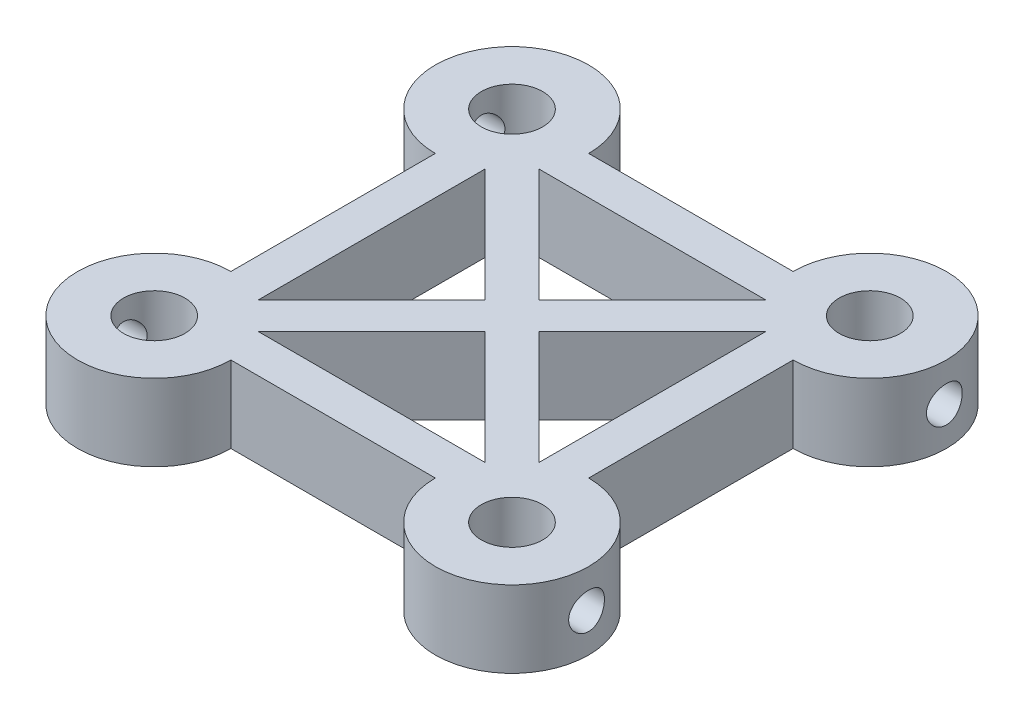
from build123d import *

# Parameters (mm, degrees)
SKETCH1_W           = 28
SKETCH1_H           = 28
BOSS_EXTRUDE1_DEPTH = 6
SKETCH2_R           = 6
BOSS_EXTRUDE2_DEPTH = 6
SKETCH3_R           = 2.4
CUT_EXTRUDE1_DEPTH  = 49.456165758
CUT_EXTRUDE2_DEPTH  = 10
SKETCH5_R           = 1.4
CUT_EXTRUDE3_DEPTH  = 10
CUT_EXTRUDE4_START  = 10
SKETCH6_R           = 1.4
CUT_EXTRUDE4_DEPTH  = 10


with BuildPart() as part:
    # Sketch1 → Boss-Extrude1 (new body)
    with BuildSketch(Plane(origin=(0, 0, 0), x_dir=(1, 0, 0), z_dir=(0, 1, 0))):
        with Locations((14, 14)):
            Rectangle(SKETCH1_W, SKETCH1_H)
    extrude(amount=BOSS_EXTRUDE1_DEPTH)

    # Sketch2 → Boss-Extrude2 (add)
    with BuildSketch(Plane(origin=(0, 6, 0), x_dir=(1, 0, 0), z_dir=(0, 1, 0))):
        with Locations((0, 28)):
            Circle(SKETCH2_R)
        with Locations((28, 28)):
            Circle(SKETCH2_R)
        with Locations((28, 0)):
            Circle(SKETCH2_R)
        Circle(SKETCH2_R)
    extrude(amount=-BOSS_EXTRUDE2_DEPTH)

    # Sketch3 → Cut-Extrude1 (cut, through all)
    with BuildSketch(Plane(origin=(0, 6, 0), x_dir=(1, 0, 0), z_dir=(0, 1, 0))):
        with Locations(Location((0, 28, 0), (0, 0, 270))):
            Circle(SKETCH3_R)
        with Locations(Location((28, 28, 0), (0, 0, 90))):
            Circle(SKETCH3_R)
        with Locations(Location((28, 0, 0), (0, 0, 270))):
            Circle(SKETCH3_R)
        with Locations(Location((0, 0, 0), (0, 0, 90))):
            Circle(SKETCH3_R)
    extrude(amount=-CUT_EXTRUDE1_DEPTH, mode=Mode.SUBTRACT)

    # Sketch4 → Cut-Extrude2 (cut)
    with BuildSketch(Plane(origin=(0, 6, 0), x_dir=(1, 0, 0), z_dir=(0, 1, 0))):
        Polygon((11.878679656, 14), (3, 22.878679656), (3, 5.121320344), align=None)
        Polygon((22.878679656, 25), (5.121320344, 25), (14, 16.121320344), align=None)
        Polygon((25, 5.121320344), (25, 22.878679656), (16.121320344, 14), align=None)
        Polygon((14, 11.878679656), (5.121320344, 3), (22.878679656, 3), align=None)
    extrude(amount=-CUT_EXTRUDE2_DEPTH, mode=Mode.SUBTRACT)

    # Sketch5 → Cut-Extrude3 (cut)
    with BuildSketch(Plane(origin=(28, 0, 0), x_dir=(0, 0, -1), z_dir=(1, 0, 0))):
        with Locations(Location((0, 3, 0), (0, 0, 180))):
            Circle(SKETCH5_R)
        with Locations(Location((28, 3, 0), (0, 0, 180))):
            Circle(SKETCH5_R)
    extrude(amount=CUT_EXTRUDE3_DEPTH, mode=Mode.SUBTRACT)

    # Sketch6 → Cut-Extrude4 (cut)
    with BuildSketch(Plane.ZY.offset(CUT_EXTRUDE4_START)):
        with Locations((-28, 3)):
            Circle(SKETCH6_R)
        with Locations((0, 3)):
            Circle(SKETCH6_R)
    extrude(amount=-CUT_EXTRUDE4_DEPTH, mode=Mode.SUBTRACT)


solid = part.part
